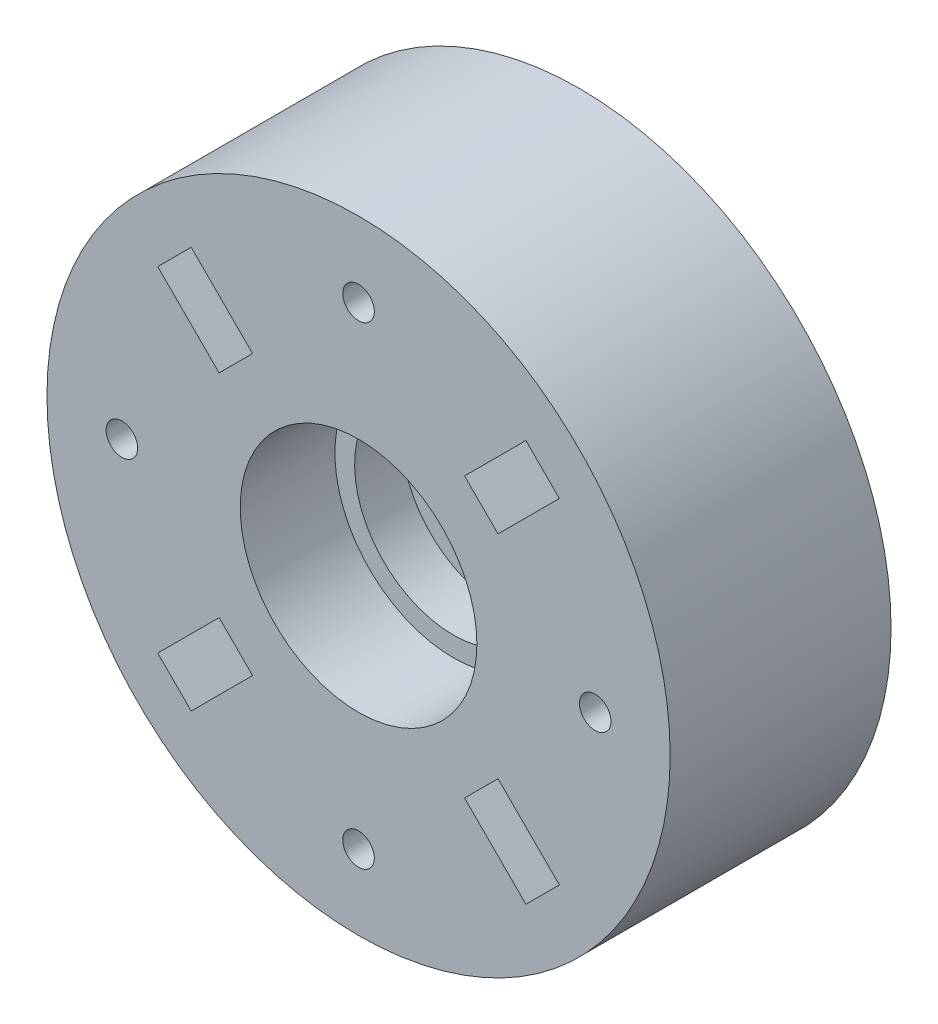
from build123d import *

# Parameters (mm, degrees)
CROQUIS1_R              = 39.5
CROQUIS1_R_2            = 12.5
CROQUIS1_R_3            = 2
SALIENTE_EXTRUIR1_DEPTH = 28
CROQUIS3_R              = 15
CORTAR_EXTRUIR1_DEPTH   = 12
CROQUIS5_R              = 16.857920318
SALIENTE_EXTRUIR2_DEPTH = 10
CROQUIS4_R              = 1.75
CORTAR_EXTRUIR2_DEPTH   = 10


with BuildPart() as part:
    # Croquis1 → Saliente-Extruir1 (new body)
    with BuildSketch(Plane.XY):
        Circle(CROQUIS1_R)
        Circle(CROQUIS1_R_2, mode=Mode.SUBTRACT)
        with Locations((0, 30)):
            Circle(CROQUIS1_R_3, mode=Mode.SUBTRACT)
        with Locations((30, 0)):
            Circle(CROQUIS1_R_3, mode=Mode.SUBTRACT)
        with Locations((0, -30)):
            Circle(CROQUIS1_R_3, mode=Mode.SUBTRACT)
        with Locations((-30, 0)):
            Circle(CROQUIS1_R_3, mode=Mode.SUBTRACT)
    extrude(amount=SALIENTE_EXTRUIR1_DEPTH)

    # Croquis3 → Cortar-Extruir1 (cut)
    with BuildSketch(Plane.XY.offset(28)):
        Circle(CROQUIS3_R)
        Polygon((17.67766953, 13.435028843), (25.455844123, 21.213203436), (21.213203436, 25.455844123), (13.435028843, 17.67766953), align=None)
        Polygon((13.435028843, -17.67766953), (21.213203436, -25.455844123), (25.455844123, -21.213203436), (17.67766953, -13.435028843), align=None)
        Polygon((-17.67766953, -13.435028843), (-25.455844123, -21.213203436), (-21.213203436, -25.455844123), (-13.435028843, -17.67766953), align=None)
        Polygon((-13.435028843, 17.67766953), (-21.213203436, 25.455844123), (-25.455844123, 21.213203436), (-17.67766953, 13.435028843), align=None)
    extrude(amount=-CORTAR_EXTRUIR1_DEPTH, mode=Mode.SUBTRACT)

    # Croquis5 → Saliente-Extruir2 (add)
    with BuildSketch(Plane(origin=(0, 0, 0), x_dir=(-1, 0, 0), z_dir=(0, 0, -1))):
        Circle(CROQUIS5_R)
    extrude(amount=-SALIENTE_EXTRUIR2_DEPTH)

    # Croquis4 → Cortar-Extruir2 (cut)
    with BuildSketch(Plane(origin=(0, 0, 0), x_dir=(-1, 0, 0), z_dir=(0, 0, -1))):
        with Locations((-12.727922061, -6.363961031)):
            Circle(CROQUIS4_R)
        with Locations((-6.363961031, -12.727922061)):
            Circle(CROQUIS4_R)
        with Locations((21.920310217, 28.284271247)):
            Circle(CROQUIS4_R)
        with Locations((28.284271247, 21.920310217)):
            Circle(CROQUIS4_R)
        Polygon((30, -3.5), (33.031088913, -1.75), (33.031088913, 1.75), (30, 3.5), (26.968911087, 1.75), (26.968911087, -1.75), align=None)
        Polygon((3.5, 30), (1.75, 33.031088913), (-1.75, 33.031088913), (-3.5, 30), (-1.75, 26.968911087), (1.75, 26.968911087), align=None)
        Polygon((-3.5, -30), (-1.75, -33.031088913), (1.75, -33.031088913), (3.5, -30), (1.75, -26.968911087), (-1.75, -26.968911087), align=None)
        Polygon((-30, 3.5), (-33.031088913, 1.75), (-33.031088913, -1.75), (-30, -3.5), (-26.968911087, -1.75), (-26.968911087, 1.75), align=None)
        Polygon((0.353553391, -13.788582233), (29.344931419, 15.202795796), (15.202795796, 29.344931419), (-13.788582233, 0.353553391), align=None)
    extrude(amount=-CORTAR_EXTRUIR2_DEPTH, mode=Mode.SUBTRACT)


solid = part.part
